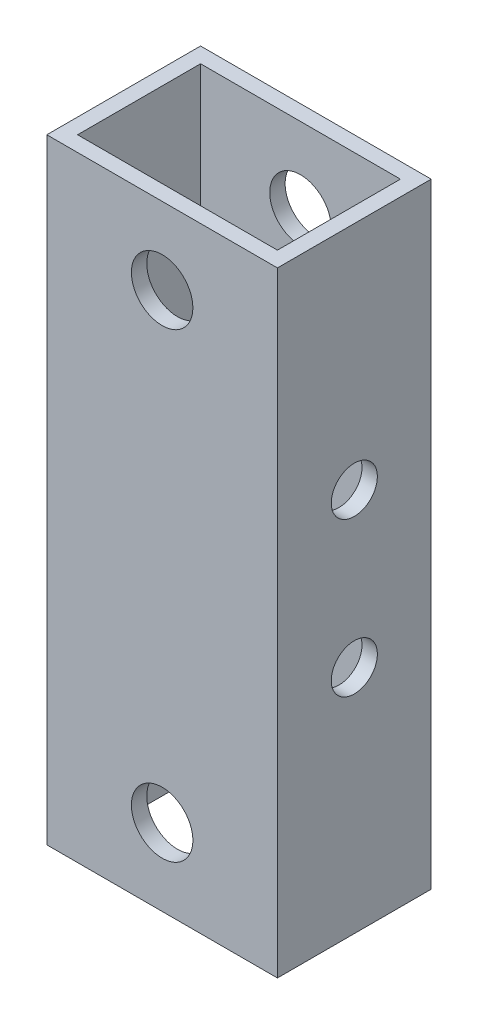
from build123d import *

# Parameters (mm, degrees)
SKETCH_1_W          = 15
SKETCH_1_H          = 10
SKETCH_1_W_2        = 13
SKETCH_1_H_2        = 8
EXTRUDE_1_DEPTH     = 40
CUT_EXTRUDE_1_REACH = 45.875
SKETCH_3_R          = 1.5
CUT_EXTRUDE_2_REACH = 45.875
SKETCH_4_R          = 2


with BuildPart() as part:
    # ｽｹｯﾁ1 → 押し出し-薄板1 (new body)
    with BuildSketch(Plane(origin=(0, 0, 0), x_dir=(1, 0, 0), z_dir=(0, 1, 0))):
        with Locations((7.5, 5)):
            Rectangle(SKETCH_1_W, SKETCH_1_H)
        with Locations((7.5, 5)):
            Rectangle(SKETCH_1_W_2, SKETCH_1_H_2, mode=Mode.SUBTRACT)
    extrude(amount=EXTRUDE_1_DEPTH)

    # ｶｯﾄ - 押し出し1: up to this face of the body (flat: up to its plane)
    cut_extrude_1_end = Plane(part.part.faces().sort_by_distance((0, 20, -5))[0])
    # ｽｹｯﾁ3 → ｶｯﾄ - 押し出し1 (cut, up to the picked face)
    with BuildSketch(Plane(origin=(15, 0, 0), x_dir=(0, 0, -1), z_dir=(1, 0, 0)), mode=Mode.PRIVATE) as cut_extrude_1_sk1:
        with Locations((5, 25)):
            Circle(SKETCH_3_R)
    cut_extrude_1_tool1 = split(extrude(cut_extrude_1_sk1.sketch, amount=-CUT_EXTRUDE_1_REACH, mode=Mode.PRIVATE), bisect_by=cut_extrude_1_end, keep=Keep.BOTH, mode=Mode.PRIVATE)
    # ｽｹｯﾁ3 → ｶｯﾄ - 押し出し1 (cut, up to the picked face)
    with BuildSketch(Plane(origin=(15, 0, 0), x_dir=(0, 0, -1), z_dir=(1, 0, 0)), mode=Mode.PRIVATE) as cut_extrude_1_sk2:
        with Locations((5, 15)):
            Circle(SKETCH_3_R)
    cut_extrude_1_tool2 = split(extrude(cut_extrude_1_sk2.sketch, amount=-CUT_EXTRUDE_1_REACH, mode=Mode.PRIVATE), bisect_by=cut_extrude_1_end, keep=Keep.BOTH, mode=Mode.PRIVATE)
    add(cut_extrude_1_tool1.solids().sort_by(Axis((15, 25, -5), (-1, 0, 0)))[0], mode=Mode.SUBTRACT)
    add(cut_extrude_1_tool2.solids().sort_by(Axis((15, 15, -5), (-1, 0, 0)))[0], mode=Mode.SUBTRACT)

    # ｶｯﾄ - 押し出し2: up to this face of the body (flat: up to its plane)
    cut_extrude_2_end = Plane(part.part.faces().sort_by_distance((7.5, 20, -10))[0])
    # ｽｹｯﾁ4 → ｶｯﾄ - 押し出し2 (cut, up to the picked face)
    with BuildSketch(Plane.XY, mode=Mode.PRIVATE) as cut_extrude_2_sk1:
        with Locations((7.5, 35)):
            Circle(SKETCH_4_R)
    cut_extrude_2_tool1 = split(extrude(cut_extrude_2_sk1.sketch, amount=-CUT_EXTRUDE_2_REACH, mode=Mode.PRIVATE), bisect_by=cut_extrude_2_end, keep=Keep.BOTH, mode=Mode.PRIVATE)
    # ｽｹｯﾁ4 → ｶｯﾄ - 押し出し2 (cut, up to the picked face)
    with BuildSketch(Plane.XY, mode=Mode.PRIVATE) as cut_extrude_2_sk2:
        with Locations((7.5, 5)):
            Circle(SKETCH_4_R)
    cut_extrude_2_tool2 = split(extrude(cut_extrude_2_sk2.sketch, amount=-CUT_EXTRUDE_2_REACH, mode=Mode.PRIVATE), bisect_by=cut_extrude_2_end, keep=Keep.BOTH, mode=Mode.PRIVATE)
    add(cut_extrude_2_tool1.solids().sort_by(Axis((7.5, 35, 0), (0, 0, -1)))[0], mode=Mode.SUBTRACT)
    add(cut_extrude_2_tool2.solids().sort_by(Axis((7.5, 5, 0), (0, 0, -1)))[0], mode=Mode.SUBTRACT)


solid = part.part
